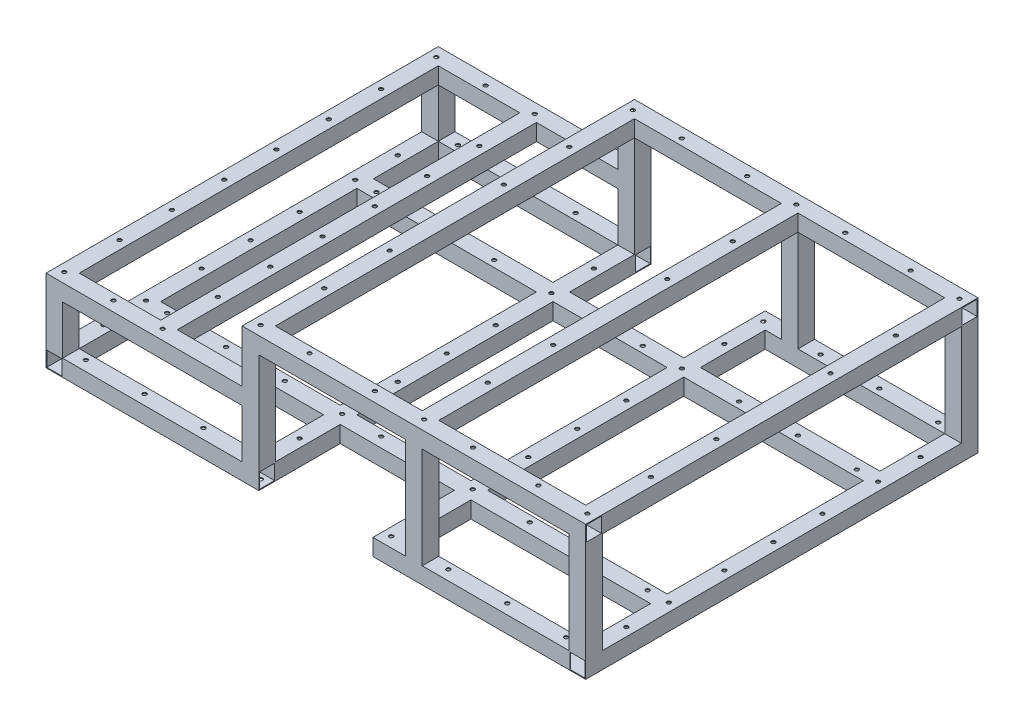
from build123d import *

# Parameters (mm, degrees)
SKETCH1_W                      = 774.6
SKETCH1_H                      = 25.4
BOSS_EXTRUDE1_DEPTH            = 25.4
BOSS_EXTRUDE1_2_DEPTH          = 25.4
SKETCH4_W                      = 23
SKETCH4_H                      = 23
CUT_EXTRUDE2_DEPTH             = 774.6
SKETCH2_W                      = 25.4
SKETCH2_H                      = 600
BOSS_EXTRUDE2_DEPTH            = 25.4
CUT_EXTRUDE1_REACH             = 730.674
SKETCH3_W                      = 23
SKETCH3_H                      = 23
SKETCH6_W                      = 25.4
SKETCH6_H                      = 25.4
BOSS_EXTRUDE3_DEPTH            = 300
SKETCH7_W                      = 25.4
SKETCH7_H                      = 25.4
BOSS_EXTRUDE4_DEPTH            = 300
CUT_EXTRUDE4_REACH             = 512.849
SKETCH8_W                      = 23
SKETCH8_H                      = 23
CUT_EXTRUDE4_DIRECTION_2_DEPTH = 388.5
BOSS_EXTRUDE5_REACH            = 709.906
SKETCH9_W                      = 25.4
SKETCH9_H                      = 25.4
SKETCH9_W_2                    = 23
SKETCH9_H_2                    = 23
SKETCH11_W                     = 25.4
SKETCH11_H                     = 25.4
SKETCH11_W_2                   = 23
SKETCH11_H_2                   = 23
BOSS_EXTRUDE6_DEPTH            = 74.6
SKETCH12_W                     = 25.4
SKETCH12_H                     = 25.4
SKETCH12_W_2                   = 23
SKETCH12_H_2                   = 23
BOSS_EXTRUDE7_DEPTH            = 154.6
SKETCH13_W                     = 525.4
SKETCH13_H                     = 25.4
BOSS_EXTRUDE9_DEPTH            = 25.4
SKETCH14_W                     = 23
SKETCH14_H                     = 23
CUT_EXTRUDE5_DEPTH             = 525.4
SKETCH15_W                     = 25.4
SKETCH15_H                     = 25.4
SKETCH15_W_2                   = 23
SKETCH15_H_2                   = 23
BOSS_EXTRUDE10_DEPTH           = 549.2
SKETCH16_W                     = 25.4
SKETCH16_H                     = 25.4
SKETCH16_W_2                   = 23
SKETCH16_H_2                   = 23
BOSS_EXTRUDE11_DEPTH           = 300
SKETCH17_W                     = 25.4
SKETCH17_H                     = 25.4
SKETCH17_W_2                   = 23
SKETCH17_H_2                   = 23
BOSS_EXTRUDE12_DEPTH           = 549.2
SKETCH18_R                     = 3
CUT_EXTRUDE6_DEPTH             = 25.4
SKETCH20_R                     = 3
CUT_EXTRUDE7_DEPTH             = 1.2
CUT_EXTRUDE8_REACH             = 527.401
SKETCH21_R                     = 3


with BuildPart() as part:
    # Sketch1 → Boss-Extrude1 (new body)
    with BuildSketch(Plane(origin=(0, 0, 0), x_dir=(1, 0, 0), z_dir=(0, 1, 0))):
        with Locations((0, -162.7)):
            Rectangle(SKETCH1_W, SKETCH1_H)
    extrude(amount=BOSS_EXTRUDE1_DEPTH)


with BuildPart() as body_2:
    # Sketch1 → Boss-Extrude1 2 (new body)
    with BuildSketch(Plane(origin=(0, 0, 0), x_dir=(1, 0, 0), z_dir=(0, 1, 0))):
        with Locations((0, 162.7)):
            Rectangle(SKETCH1_W, SKETCH1_H)
    extrude(amount=BOSS_EXTRUDE1_2_DEPTH)


with BuildPart() as cut_extrude2_tool:
    # Sketch4 → Cut-Extrude2 (new body)
    with BuildSketch(Plane.ZY.offset(387.3)):
        with Locations((-162.7, 12.7)):
            Rectangle(SKETCH4_W, SKETCH4_H)
        with Locations((162.7, 12.7)):
            Rectangle(SKETCH4_W, SKETCH4_H)
    extrude(amount=-CUT_EXTRUDE2_DEPTH)


with BuildPart() as part_1:
    add(part.part)

    # Cut-Extrude2: cut by cut_extrude2_tool
    add(cut_extrude2_tool.part, mode=Mode.SUBTRACT)



with BuildPart() as body_2_1:
    add(body_2.part)

    # Cut-Extrude2: cut by cut_extrude2_tool
    add(cut_extrude2_tool.part, mode=Mode.SUBTRACT)


with BuildPart() as part_2:
    add(part_1.part)

    add(body_2_1.part)  # Boss-Extrude2 merges body 2
    # Sketch2 → Boss-Extrude2 (add)
    with BuildSketch(Plane.XZ):
        with Locations((400, 0)):
            Rectangle(SKETCH2_W, SKETCH2_H)
        with Locations((-400, 0)):
            Rectangle(SKETCH2_W, SKETCH2_H)
    extrude(amount=-BOSS_EXTRUDE2_DEPTH)

    # Sketch3 → Cut-Extrude1 (cut, up to next)
    with BuildSketch(Plane(origin=(0, 0, -300), x_dir=(-1, 0, 0), z_dir=(0, 0, -1)), mode=Mode.PRIVATE) as cut_extrude1_sk1:
        with Locations((-400, 12.7)):
            Rectangle(SKETCH3_W, SKETCH3_H)
    cut_extrude1_tool1 = extrude(cut_extrude1_sk1.sketch, amount=-CUT_EXTRUDE1_REACH, mode=Mode.PRIVATE) & part_2.part
    # Sketch3 → Cut-Extrude1 (cut, up to next)
    with BuildSketch(Plane(origin=(0, 0, -300), x_dir=(-1, 0, 0), z_dir=(0, 0, -1)), mode=Mode.PRIVATE) as cut_extrude1_sk2:
        with Locations((400, 12.7)):
            Rectangle(SKETCH3_W, SKETCH3_H)
    cut_extrude1_tool2 = extrude(cut_extrude1_sk2.sketch, amount=-CUT_EXTRUDE1_REACH, mode=Mode.PRIVATE) & part_2.part
    add(cut_extrude1_tool1.solids().sort_by_distance((400, 12.7, -300))[0], mode=Mode.SUBTRACT)
    add(cut_extrude1_tool2.solids().sort_by_distance((-400, 12.7, -300))[0], mode=Mode.SUBTRACT)

    # Sketch6 → Boss-Extrude3 (add)
    with BuildSketch(Plane(origin=(-387.3, 0, 0), x_dir=(0, 0, -1), z_dir=(1, 0, 0))):
        with Locations((287.3, 12.7)):
            Rectangle(SKETCH6_W, SKETCH6_H)
        with Locations((-287.3, 12.7)):
            Rectangle(SKETCH6_W, SKETCH6_H)
    extrude(amount=BOSS_EXTRUDE3_DEPTH)

    # Sketch7 → Boss-Extrude4 (add)
    with BuildSketch(Plane.ZY.offset(-387.3)):
        with Locations((-287.3, 12.7)):
            Rectangle(SKETCH7_W, SKETCH7_H)
        with Locations((287.3, 12.7)):
            Rectangle(SKETCH7_W, SKETCH7_H)
    extrude(amount=BOSS_EXTRUDE4_DEPTH)

    # Cut-Extrude4: up to this face of the body (flat: up to its plane)
    cut_extrude4_end = Plane(part_2.part.faces().sort_by_distance((-388.5, 12.7, 0))[0])
    # Sketch8 → Cut-Extrude4 (cut, up to the picked face)
    with BuildSketch(Plane(origin=(0, 0, 0), x_dir=(0, 0, -1), z_dir=(1, 0, 0)), mode=Mode.PRIVATE) as cut_extrude4_sk1:
        with Locations((-287.3, 12.7)):
            Rectangle(SKETCH8_W, SKETCH8_H)
    cut_extrude4_tool1 = split(extrude(cut_extrude4_sk1.sketch, amount=-CUT_EXTRUDE4_REACH, mode=Mode.PRIVATE), bisect_by=cut_extrude4_end, keep=Keep.BOTH, mode=Mode.PRIVATE)
    # Sketch8 → Cut-Extrude4 (cut, up to the picked face)
    with BuildSketch(Plane(origin=(0, 0, 0), x_dir=(0, 0, -1), z_dir=(1, 0, 0)), mode=Mode.PRIVATE) as cut_extrude4_sk2:
        with Locations((287.3, 12.7)):
            Rectangle(SKETCH8_W, SKETCH8_H)
    cut_extrude4_tool2 = split(extrude(cut_extrude4_sk2.sketch, amount=-CUT_EXTRUDE4_REACH, mode=Mode.PRIVATE), bisect_by=cut_extrude4_end, keep=Keep.BOTH, mode=Mode.PRIVATE)
    add(cut_extrude4_tool1.solids().sort_by(Axis((0, 12.7, 287.3), (-1, 0, 0)))[0], mode=Mode.SUBTRACT)
    add(cut_extrude4_tool2.solids().sort_by(Axis((0, 12.7, -287.3), (-1, 0, 0)))[0], mode=Mode.SUBTRACT)

    # Sketch8 → Cut-Extrude4 direction 2 (cut)
    with BuildSketch(Plane(origin=(0, 0, 0), x_dir=(0, 0, -1), z_dir=(1, 0, 0))):
        with Locations((-287.3, 12.7)):
            Rectangle(SKETCH8_W, SKETCH8_H)
        with Locations((287.3, 12.7)):
            Rectangle(SKETCH8_W, SKETCH8_H)
    extrude(amount=CUT_EXTRUDE4_DIRECTION_2_DEPTH, mode=Mode.SUBTRACT)

    # Boss-Extrude5: up to this face of the body (flat: up to its plane)
    boss_extrude5_end = Plane(part_2.part.faces().sort_by_distance((-237.9, 12.7, 275.8))[0])
    # Sketch9 → Boss-Extrude5 (add, up to the picked face)
    with BuildSketch(Plane.XY.offset(-274.6), mode=Mode.PRIVATE) as boss_extrude5_sk1:
        with Locations((-100, 12.7)):
            Rectangle(SKETCH9_W, SKETCH9_H)
        with Locations((-100, 12.7)):
            Rectangle(SKETCH9_W_2, SKETCH9_H_2, mode=Mode.SUBTRACT)
    boss_extrude5_tool1 = split(extrude(boss_extrude5_sk1.sketch, amount=BOSS_EXTRUDE5_REACH, mode=Mode.PRIVATE), bisect_by=boss_extrude5_end, keep=Keep.BOTH, mode=Mode.PRIVATE)
    # Sketch9 → Boss-Extrude5 (add, up to the picked face)
    with BuildSketch(Plane.XY.offset(-274.6), mode=Mode.PRIVATE) as boss_extrude5_sk2:
        with Locations((100, 12.7)):
            Rectangle(SKETCH9_W, SKETCH9_H)
        with Locations((100, 12.7)):
            Rectangle(SKETCH9_W_2, SKETCH9_H_2, mode=Mode.SUBTRACT)
    boss_extrude5_tool2 = split(extrude(boss_extrude5_sk2.sketch, amount=BOSS_EXTRUDE5_REACH, mode=Mode.PRIVATE), bisect_by=boss_extrude5_end, keep=Keep.BOTH, mode=Mode.PRIVATE)
    add(boss_extrude5_tool1.solids().sort_by(Axis((-100, 0.35921, -274.6), (0, 0, 1)))[0])
    add(boss_extrude5_tool2.solids().sort_by(Axis((100, 25.04079, -274.6), (0, 0, 1)))[0])

    # Sketch11 → Boss-Extrude6 (add)
    # profile 1 of 2: a face of its own
    with BuildSketch(Plane(origin=(0, 25.4, 0), x_dir=(1, 0, 0), z_dir=(0, 1, 0))):
        with Locations((-400, 287.3)):
            Rectangle(SKETCH11_W, SKETCH11_H)
        with Locations((-400, 287.3)):
            Rectangle(SKETCH11_W_2, SKETCH11_H_2, mode=Mode.SUBTRACT)
    # profile 2 of 2: a face of its own
    with BuildSketch(Plane(origin=(0, 25.4, 0), x_dir=(1, 0, 0), z_dir=(0, 1, 0))):
        with Locations((-400, -287.3)):
            Rectangle(SKETCH11_W, SKETCH11_H)
        with Locations((-400, -287.3)):
            Rectangle(SKETCH11_W_2, SKETCH11_H_2, mode=Mode.SUBTRACT)
    extrude(amount=BOSS_EXTRUDE6_DEPTH)

    # Sketch12 → Boss-Extrude7 (add)
    # profile 1 of 6: a face of its own
    with BuildSketch(Plane(origin=(0, 25.4, 0), x_dir=(1, 0, 0), z_dir=(0, 1, 0))):
        with Locations((-100, 287.3)):
            Rectangle(SKETCH12_W, SKETCH12_H)
        with Locations((-100, 287.3)):
            Rectangle(SKETCH12_W_2, SKETCH12_H_2, mode=Mode.SUBTRACT)
    # profile 2 of 6: a face of its own
    with BuildSketch(Plane(origin=(0, 25.4, 0), x_dir=(1, 0, 0), z_dir=(0, 1, 0))):
        with Locations((-100, -287.3)):
            Rectangle(SKETCH12_W, SKETCH12_H)
        with Locations((-100, -287.3)):
            Rectangle(SKETCH12_W_2, SKETCH12_H_2, mode=Mode.SUBTRACT)
    # profile 3 of 6: a face of its own
    with BuildSketch(Plane(origin=(0, 25.4, 0), x_dir=(1, 0, 0), z_dir=(0, 1, 0))):
        with Locations((400, -287.3)):
            Rectangle(SKETCH12_W, SKETCH12_H)
        with Locations((400, -287.3)):
            Rectangle(SKETCH12_W_2, SKETCH12_H_2, mode=Mode.SUBTRACT)
    # profile 4 of 6: a face of its own
    with BuildSketch(Plane(origin=(0, 25.4, 0), x_dir=(1, 0, 0), z_dir=(0, 1, 0))):
        with Locations((400, 287.3)):
            Rectangle(SKETCH12_W, SKETCH12_H)
        with Locations((400, 287.3)):
            Rectangle(SKETCH12_W_2, SKETCH12_H_2, mode=Mode.SUBTRACT)
    # profile 5 of 6: a face of its own
    with BuildSketch(Plane(origin=(0, 25.4, 0), x_dir=(1, 0, 0), z_dir=(0, 1, 0))):
        with Locations((150, 287.3)):
            Rectangle(SKETCH12_W, SKETCH12_H)
        with Locations((150, 287.3)):
            Rectangle(SKETCH12_W_2, SKETCH12_H_2, mode=Mode.SUBTRACT)
    # profile 6 of 6: a face of its own
    with BuildSketch(Plane(origin=(0, 25.4, 0), x_dir=(1, 0, 0), z_dir=(0, 1, 0))):
        with Locations((150, -287.3)):
            Rectangle(SKETCH12_W, SKETCH12_H)
        with Locations((150, -287.3)):
            Rectangle(SKETCH12_W_2, SKETCH12_H_2, mode=Mode.SUBTRACT)
    extrude(amount=BOSS_EXTRUDE7_DEPTH)

    # Sketch13 → Boss-Extrude9 (add)
    with BuildSketch(Plane(origin=(0, 180, 0), x_dir=(1, 0, 0), z_dir=(0, 1, 0))):
        with Locations((150, -287.3)):
            Rectangle(SKETCH13_W, SKETCH13_H)
        with Locations((150, 287.3)):
            Rectangle(SKETCH13_W, SKETCH13_H)
    extrude(amount=BOSS_EXTRUDE9_DEPTH)

    # Sketch14 → Cut-Extrude5 (cut)
    with BuildSketch(Plane.ZY.offset(112.7)):
        with Locations((-287.3, 192.7)):
            Rectangle(SKETCH14_W, SKETCH14_H)
        with Locations((287.3, 192.7)):
            Rectangle(SKETCH14_W, SKETCH14_H)
    extrude(amount=-CUT_EXTRUDE5_DEPTH, mode=Mode.SUBTRACT)

    # Sketch15 → Boss-Extrude10 (add)
    # profile 1 of 3: a face of its own
    with BuildSketch(Plane.XY.offset(-274.6)):
        with Locations((-100, 192.7)):
            Rectangle(SKETCH15_W, SKETCH15_H)
        with Locations((-100, 192.7)):
            Rectangle(SKETCH15_W_2, SKETCH15_H_2, mode=Mode.SUBTRACT)
    # profile 2 of 3: a face of its own
    with BuildSketch(Plane.XY.offset(-274.6)):
        with Locations((150, 192.7)):
            Rectangle(SKETCH15_W, SKETCH15_H)
        with Locations((150, 192.7)):
            Rectangle(SKETCH15_W_2, SKETCH15_H_2, mode=Mode.SUBTRACT)
    # profile 3 of 3: a face of its own
    with BuildSketch(Plane.XY.offset(-274.6)):
        with Locations((400, 192.7)):
            Rectangle(SKETCH15_W, SKETCH15_H)
        with Locations((400, 192.7)):
            Rectangle(SKETCH15_W_2, SKETCH15_H_2, mode=Mode.SUBTRACT)
    extrude(amount=BOSS_EXTRUDE10_DEPTH)

    # Sketch16 → Boss-Extrude11 (add)
    # profile 1 of 2: a face of its own
    with BuildSketch(Plane.ZY.offset(412.7)):
        with Locations((287.3, 112.7)):
            Rectangle(SKETCH16_W, SKETCH16_H)
        with Locations((287.3, 112.7)):
            Rectangle(SKETCH16_W_2, SKETCH16_H_2, mode=Mode.SUBTRACT)
    # profile 2 of 2: a face of its own
    with BuildSketch(Plane.ZY.offset(412.7)):
        with Locations((-287.3, 112.7)):
            Rectangle(SKETCH16_W, SKETCH16_H)
        with Locations((-287.3, 112.7)):
            Rectangle(SKETCH16_W_2, SKETCH16_H_2, mode=Mode.SUBTRACT)
    extrude(amount=-BOSS_EXTRUDE11_DEPTH)

    # Sketch17 → Boss-Extrude12 (add)
    # profile 1 of 2: a face of its own
    with BuildSketch(Plane(origin=(0, 0, 274.6), x_dir=(-1, 0, 0), z_dir=(0, 0, -1))):
        with Locations((400, 112.7)):
            Rectangle(SKETCH17_W, SKETCH17_H)
        with Locations((400, 112.7)):
            Rectangle(SKETCH17_W_2, SKETCH17_H_2, mode=Mode.SUBTRACT)
    # profile 2 of 2: a face of its own
    with BuildSketch(Plane(origin=(0, 0, 274.6), x_dir=(-1, 0, 0), z_dir=(0, 0, -1))):
        with Locations((250, 112.7)):
            Rectangle(SKETCH17_W, SKETCH17_H)
        with Locations((250, 112.7)):
            Rectangle(SKETCH17_W_2, SKETCH17_H_2, mode=Mode.SUBTRACT)
    extrude(amount=BOSS_EXTRUDE12_DEPTH)

    # Sketch18 → Cut-Extrude6 (cut)
    with BuildSketch(Plane(origin=(0, 25.4, 0), x_dir=(1, 0, 0), z_dir=(0, 1, 0))):
        with Locations(Location((367.3, 284.6, 0), (0, 0, 270))):
            Circle(SKETCH18_R)
        with Locations(Location((277.3, 284.6, 0), (0, 0, 270))):
            Circle(SKETCH18_R)
        with Locations(Location((187.3, 284.6, 0), (0, 0, 270))):
            Circle(SKETCH18_R)
        with Locations(Location((99.8, 284.6, 0), (0, 0, 270))):
            Circle(SKETCH18_R)
        with Locations(Location((367.3, 160, 0), (0, 0, 270))):
            Circle(SKETCH18_R)
        with Locations(Location((277.3, 160, 0), (0, 0, 270))):
            Circle(SKETCH18_R)
        with Locations(Location((187.3, 160, 0), (0, 0, 270))):
            Circle(SKETCH18_R)
        with Locations(Location((99.8, 160, 0), (0, 0, 270))):
            Circle(SKETCH18_R)
        with Locations(Location((99.8, 225, 0), (0, 0, 270))):
            Circle(SKETCH18_R)
        with Locations(Location((399.8, 225, 0), (0, 0, 270))):
            Circle(SKETCH18_R)
        with Locations(Location((399.8, 0, 0), (0, 0, 270))):
            Circle(SKETCH18_R)
        with Locations(Location((399.8, 75, 0), (0, 0, 270))):
            Circle(SKETCH18_R)
        with Locations(Location((99.8, 0, 0), (0, 0, 270))):
            Circle(SKETCH18_R)
        with Locations(Location((99.8, 75, 0), (0, 0, 270))):
            Circle(SKETCH18_R)
        with Locations(Location((399.8, 160, 0), (0, 0, 270))):
            Circle(SKETCH18_R)
        with Locations(Location((40, 160, 0), (0, 0, 270))):
            Circle(SKETCH18_R)
        with Locations(Location((-40, 160, 0), (0, 0, 270))):
            Circle(SKETCH18_R)
        with Locations(Location((-399.8, 160, 0), (0, 0, 270))):
            Circle(SKETCH18_R)
        with Locations((-99.8, 75)):
            Circle(SKETCH18_R)
        with Locations((-99.8, 0)):
            Circle(SKETCH18_R)
        with Locations(Location((-399.8, 75, 0), (0, 0, 270))):
            Circle(SKETCH18_R)
        with Locations(Location((-399.8, 0, 0), (0, 0, 270))):
            Circle(SKETCH18_R)
        with Locations(Location((-399.8, 225, 0), (0, 0, 270))):
            Circle(SKETCH18_R)
        with Locations((-99.8, 225)):
            Circle(SKETCH18_R)
        with Locations(Location((-99.8, 160, 0), (0, 0, 270))):
            Circle(SKETCH18_R)
        with Locations(Location((-187.3, 160, 0), (0, 0, 270))):
            Circle(SKETCH18_R)
        with Locations(Location((-277.3, 160, 0), (0, 0, 270))):
            Circle(SKETCH18_R)
        with Locations(Location((-367.3, 160, 0), (0, 0, 270))):
            Circle(SKETCH18_R)
        with Locations(Location((-99.8, 284.6, 0), (0, 0, 270))):
            Circle(SKETCH18_R)
        with Locations(Location((-187.3, 284.6, 0), (0, 0, 270))):
            Circle(SKETCH18_R)
        with Locations(Location((-277.3, 284.6, 0), (0, 0, 270))):
            Circle(SKETCH18_R)
        with Locations(Location((-367.3, 284.6, 0), (0, 0, 270))):
            Circle(SKETCH18_R)
        with Locations(Location((-367.3, -284.6, 0), (0, 0, 270))):
            Circle(SKETCH18_R)
        with Locations(Location((-277.3, -284.6, 0), (0, 0, 270))):
            Circle(SKETCH18_R)
        with Locations(Location((-187.3, -284.6, 0), (0, 0, 270))):
            Circle(SKETCH18_R)
        with Locations(Location((-99.8, -284.6, 0), (0, 0, 270))):
            Circle(SKETCH18_R)
        with Locations(Location((-367.3, -160, 0), (0, 0, 270))):
            Circle(SKETCH18_R)
        with Locations(Location((-277.3, -160, 0), (0, 0, 270))):
            Circle(SKETCH18_R)
        with Locations(Location((-187.3, -160, 0), (0, 0, 270))):
            Circle(SKETCH18_R)
        with Locations(Location((-99.8, -160, 0), (0, 0, 270))):
            Circle(SKETCH18_R)
        with Locations(Location((-99.8, -225, 0), (0, 0, 270))):
            Circle(SKETCH18_R)
        with Locations(Location((-399.8, -225, 0), (0, 0, 270))):
            Circle(SKETCH18_R)
        with Locations(Location((-399.8, -75, 0), (0, 0, 270))):
            Circle(SKETCH18_R)
        with Locations(Location((-99.8, -75, 0), (0, 0, 270))):
            Circle(SKETCH18_R)
        with Locations(Location((-399.8, -160, 0), (0, 0, 270))):
            Circle(SKETCH18_R)
        with Locations(Location((-40, -160, 0), (0, 0, 270))):
            Circle(SKETCH18_R)
        with Locations(Location((40, -160, 0), (0, 0, 270))):
            Circle(SKETCH18_R)
        with Locations(Location((399.8, -160, 0), (0, 0, 270))):
            Circle(SKETCH18_R)
        with Locations((99.8, -75)):
            Circle(SKETCH18_R)
        with Locations(Location((399.8, -75, 0), (0, 0, 270))):
            Circle(SKETCH18_R)
        with Locations(Location((399.8, -225, 0), (0, 0, 270))):
            Circle(SKETCH18_R)
        with Locations((99.8, -225)):
            Circle(SKETCH18_R)
        with Locations(Location((99.8, -160, 0), (0, 0, 270))):
            Circle(SKETCH18_R)
        with Locations(Location((187.3, -160, 0), (0, 0, 270))):
            Circle(SKETCH18_R)
        with Locations(Location((277.3, -160, 0), (0, 0, 270))):
            Circle(SKETCH18_R)
        with Locations(Location((367.3, -160, 0), (0, 0, 270))):
            Circle(SKETCH18_R)
        with Locations(Location((99.8, -284.6, 0), (0, 0, 270))):
            Circle(SKETCH18_R)
        with Locations(Location((187.3, -284.6, 0), (0, 0, 270))):
            Circle(SKETCH18_R)
        with Locations(Location((277.3, -284.6, 0), (0, 0, 270))):
            Circle(SKETCH18_R)
        with Locations(Location((367.3, -284.6, 0), (0, 0, 270))):
            Circle(SKETCH18_R)
    extrude(amount=-CUT_EXTRUDE6_DEPTH, mode=Mode.SUBTRACT)

    # Sketch20 → Cut-Extrude7 (cut)
    with BuildSketch(Plane(origin=(0, 205.4, 0), x_dir=(1, 0, 0), z_dir=(0, 1, 0))):
        with Locations(Location((399.8, 284.6, 0), (0, 0, 270))):
            Circle(SKETCH20_R)
        with Locations(Location((399.8, 187.3, 0), (0, 0, 270))):
            Circle(SKETCH20_R)
        with Locations(Location((325, 284.6, 0), (0, 0, 270))):
            Circle(SKETCH20_R)
        with Locations(Location((225, 284.6, 0), (0, 0, 270))):
            Circle(SKETCH20_R)
        with Locations(Location((150.2, 187.3, 0), (0, 0, 90))):
            Circle(SKETCH20_R)
        with Locations(Location((150.2, 284.6, 0), (0, 0, 270))):
            Circle(SKETCH20_R)
        with Locations(Location((150.2, 87.3, 0), (0, 0, 270))):
            Circle(SKETCH20_R)
        with Locations(Location((399.8, 87.3, 0), (0, 0, 90))):
            Circle(SKETCH20_R)
        with Locations(Location((399.8, -87.3, 0), (0, 0, 270))):
            Circle(SKETCH20_R)
        with Locations(Location((150.2, -87.3, 0), (0, 0, 90))):
            Circle(SKETCH20_R)
        with Locations(Location((150.2, -284.6, 0), (0, 0, 270))):
            Circle(SKETCH20_R)
        with Locations(Location((150.2, -187.3, 0), (0, 0, 270))):
            Circle(SKETCH20_R)
        with Locations(Location((225, -284.6, 0), (0, 0, 270))):
            Circle(SKETCH20_R)
        with Locations(Location((325, -284.6, 0), (0, 0, 270))):
            Circle(SKETCH20_R)
        with Locations(Location((399.8, -187.3, 0), (0, 0, 90))):
            Circle(SKETCH20_R)
        with Locations(Location((399.8, -284.6, 0), (0, 0, 270))):
            Circle(SKETCH20_R)
        with Locations(Location((-99.8, -284.6, 0), (0, 0, 270))):
            Circle(SKETCH20_R)
        with Locations(Location((-99.8, -187.3, 0), (0, 0, 270))):
            Circle(SKETCH20_R)
        with Locations(Location((-25, -284.6, 0), (0, 0, 270))):
            Circle(SKETCH20_R)
        with Locations(Location((75, -284.6, 0), (0, 0, 270))):
            Circle(SKETCH20_R)
        with Locations(Location((-99.8, -87.3, 0), (0, 0, 90))):
            Circle(SKETCH20_R)
        with Locations(Location((-99.8, 87.3, 0), (0, 0, 270))):
            Circle(SKETCH20_R)
        with Locations(Location((75, 284.6, 0), (0, 0, 270))):
            Circle(SKETCH20_R)
        with Locations(Location((-25, 284.6, 0), (0, 0, 270))):
            Circle(SKETCH20_R)
        with Locations(Location((-99.8, 187.3, 0), (0, 0, 90))):
            Circle(SKETCH20_R)
        with Locations(Location((-99.8, 284.6, 0), (0, 0, 270))):
            Circle(SKETCH20_R)
    extrude(amount=-CUT_EXTRUDE7_DEPTH, mode=Mode.SUBTRACT)

    # Sketch21 → Cut-Extrude8 (cut, up to next)
    with BuildSketch(Plane(origin=(0, 125.4, 0), x_dir=(1, 0, 0), z_dir=(0, 1, 0)), mode=Mode.PRIVATE) as cut_extrude8_sk1:
        with Locations(Location((-400.2, 284.6, 0), (0, 0, 270))):
            Circle(SKETCH21_R)
    cut_extrude8_tool1 = extrude(cut_extrude8_sk1.sketch, amount=-CUT_EXTRUDE8_REACH, mode=Mode.PRIVATE) & part_2.part
    # Sketch21 → Cut-Extrude8 (cut, up to next)
    with BuildSketch(Plane(origin=(0, 125.4, 0), x_dir=(1, 0, 0), z_dir=(0, 1, 0)), mode=Mode.PRIVATE) as cut_extrude8_sk2:
        with Locations(Location((-324.995, 284.6, 0), (0, 0, 270))):
            Circle(SKETCH21_R)
    cut_extrude8_tool2 = extrude(cut_extrude8_sk2.sketch, amount=-CUT_EXTRUDE8_REACH, mode=Mode.PRIVATE) & part_2.part
    # Sketch21 → Cut-Extrude8 (cut, up to next)
    with BuildSketch(Plane(origin=(0, 125.4, 0), x_dir=(1, 0, 0), z_dir=(0, 1, 0)), mode=Mode.PRIVATE) as cut_extrude8_sk3:
        with Locations(Location((-400.2, 200, 0), (0, 0, 270))):
            Circle(SKETCH21_R)
    cut_extrude8_tool3 = extrude(cut_extrude8_sk3.sketch, amount=-CUT_EXTRUDE8_REACH, mode=Mode.PRIVATE) & part_2.part
    # Sketch21 → Cut-Extrude8 (cut, up to next)
    with BuildSketch(Plane(origin=(0, 125.4, 0), x_dir=(1, 0, 0), z_dir=(0, 1, 0)), mode=Mode.PRIVATE) as cut_extrude8_sk4:
        with Locations(Location((-400.2, 120, 0), (0, 0, 270))):
            Circle(SKETCH21_R)
    cut_extrude8_tool4 = extrude(cut_extrude8_sk4.sketch, amount=-CUT_EXTRUDE8_REACH, mode=Mode.PRIVATE) & part_2.part
    # Sketch21 → Cut-Extrude8 (cut, up to next)
    with BuildSketch(Plane(origin=(0, 125.4, 0), x_dir=(1, 0, 0), z_dir=(0, 1, 0)), mode=Mode.PRIVATE) as cut_extrude8_sk5:
        with Locations(Location((-400.2, 40, 0), (0, 0, 270))):
            Circle(SKETCH21_R)
    cut_extrude8_tool5 = extrude(cut_extrude8_sk5.sketch, amount=-CUT_EXTRUDE8_REACH, mode=Mode.PRIVATE) & part_2.part
    # Sketch21 → Cut-Extrude8 (cut, up to next)
    with BuildSketch(Plane(origin=(0, 125.4, 0), x_dir=(1, 0, 0), z_dir=(0, 1, 0)), mode=Mode.PRIVATE) as cut_extrude8_sk6:
        with Locations(Location((-249.8, 40, 0), (0, 0, 90))):
            Circle(SKETCH21_R)
    cut_extrude8_tool6 = extrude(cut_extrude8_sk6.sketch, amount=-CUT_EXTRUDE8_REACH, mode=Mode.PRIVATE) & part_2.part
    # Sketch21 → Cut-Extrude8 (cut, up to next)
    with BuildSketch(Plane(origin=(0, 125.4, 0), x_dir=(1, 0, 0), z_dir=(0, 1, 0)), mode=Mode.PRIVATE) as cut_extrude8_sk7:
        with Locations(Location((-249.8, 120, 0), (0, 0, 90))):
            Circle(SKETCH21_R)
    cut_extrude8_tool7 = extrude(cut_extrude8_sk7.sketch, amount=-CUT_EXTRUDE8_REACH, mode=Mode.PRIVATE) & part_2.part
    # Sketch21 → Cut-Extrude8 (cut, up to next)
    with BuildSketch(Plane(origin=(0, 125.4, 0), x_dir=(1, 0, 0), z_dir=(0, 1, 0)), mode=Mode.PRIVATE) as cut_extrude8_sk8:
        with Locations(Location((-249.8, 200, 0), (0, 0, 90))):
            Circle(SKETCH21_R)
    cut_extrude8_tool8 = extrude(cut_extrude8_sk8.sketch, amount=-CUT_EXTRUDE8_REACH, mode=Mode.PRIVATE) & part_2.part
    # Sketch21 → Cut-Extrude8 (cut, up to next)
    with BuildSketch(Plane(origin=(0, 125.4, 0), x_dir=(1, 0, 0), z_dir=(0, 1, 0)), mode=Mode.PRIVATE) as cut_extrude8_sk9:
        with Locations(Location((-249.8, 284.6, 0), (0, 0, 270))):
            Circle(SKETCH21_R)
    cut_extrude8_tool9 = extrude(cut_extrude8_sk9.sketch, amount=-CUT_EXTRUDE8_REACH, mode=Mode.PRIVATE) & part_2.part
    # Sketch21 → Cut-Extrude8 (cut, up to next)
    with BuildSketch(Plane(origin=(0, 125.4, 0), x_dir=(1, 0, 0), z_dir=(0, 1, 0)), mode=Mode.PRIVATE) as cut_extrude8_sk10:
        with Locations(Location((-249.8, -284.6, 0), (0, 0, 270))):
            Circle(SKETCH21_R)
    cut_extrude8_tool10 = extrude(cut_extrude8_sk10.sketch, amount=-CUT_EXTRUDE8_REACH, mode=Mode.PRIVATE) & part_2.part
    # Sketch21 → Cut-Extrude8 (cut, up to next)
    with BuildSketch(Plane(origin=(0, 125.4, 0), x_dir=(1, 0, 0), z_dir=(0, 1, 0)), mode=Mode.PRIVATE) as cut_extrude8_sk11:
        with Locations(Location((-249.8, -200, 0), (0, 0, 270))):
            Circle(SKETCH21_R)
    cut_extrude8_tool11 = extrude(cut_extrude8_sk11.sketch, amount=-CUT_EXTRUDE8_REACH, mode=Mode.PRIVATE) & part_2.part
    # Sketch21 → Cut-Extrude8 (cut, up to next)
    with BuildSketch(Plane(origin=(0, 125.4, 0), x_dir=(1, 0, 0), z_dir=(0, 1, 0)), mode=Mode.PRIVATE) as cut_extrude8_sk12:
        with Locations(Location((-249.8, -120, 0), (0, 0, 270))):
            Circle(SKETCH21_R)
    cut_extrude8_tool12 = extrude(cut_extrude8_sk12.sketch, amount=-CUT_EXTRUDE8_REACH, mode=Mode.PRIVATE) & part_2.part
    # Sketch21 → Cut-Extrude8 (cut, up to next)
    with BuildSketch(Plane(origin=(0, 125.4, 0), x_dir=(1, 0, 0), z_dir=(0, 1, 0)), mode=Mode.PRIVATE) as cut_extrude8_sk13:
        with Locations(Location((-400.2, -40, 0), (0, 0, 90))):
            Circle(SKETCH21_R)
    cut_extrude8_tool13 = extrude(cut_extrude8_sk13.sketch, amount=-CUT_EXTRUDE8_REACH, mode=Mode.PRIVATE) & part_2.part
    # Sketch21 → Cut-Extrude8 (cut, up to next)
    with BuildSketch(Plane(origin=(0, 125.4, 0), x_dir=(1, 0, 0), z_dir=(0, 1, 0)), mode=Mode.PRIVATE) as cut_extrude8_sk14:
        with Locations(Location((-400.2, -120, 0), (0, 0, 90))):
            Circle(SKETCH21_R)
    cut_extrude8_tool14 = extrude(cut_extrude8_sk14.sketch, amount=-CUT_EXTRUDE8_REACH, mode=Mode.PRIVATE) & part_2.part
    # Sketch21 → Cut-Extrude8 (cut, up to next)
    with BuildSketch(Plane(origin=(0, 125.4, 0), x_dir=(1, 0, 0), z_dir=(0, 1, 0)), mode=Mode.PRIVATE) as cut_extrude8_sk15:
        with Locations(Location((-400.2, -200, 0), (0, 0, 90))):
            Circle(SKETCH21_R)
    cut_extrude8_tool15 = extrude(cut_extrude8_sk15.sketch, amount=-CUT_EXTRUDE8_REACH, mode=Mode.PRIVATE) & part_2.part
    # Sketch21 → Cut-Extrude8 (cut, up to next)
    with BuildSketch(Plane(origin=(0, 125.4, 0), x_dir=(1, 0, 0), z_dir=(0, 1, 0)), mode=Mode.PRIVATE) as cut_extrude8_sk16:
        with Locations(Location((-324.995, -284.6, 0), (0, 0, 270))):
            Circle(SKETCH21_R)
    cut_extrude8_tool16 = extrude(cut_extrude8_sk16.sketch, amount=-CUT_EXTRUDE8_REACH, mode=Mode.PRIVATE) & part_2.part
    # Sketch21 → Cut-Extrude8 (cut, up to next)
    with BuildSketch(Plane(origin=(0, 125.4, 0), x_dir=(1, 0, 0), z_dir=(0, 1, 0)), mode=Mode.PRIVATE) as cut_extrude8_sk17:
        with Locations(Location((-400.2, -284.6, 0), (0, 0, 270))):
            Circle(SKETCH21_R)
    cut_extrude8_tool17 = extrude(cut_extrude8_sk17.sketch, amount=-CUT_EXTRUDE8_REACH, mode=Mode.PRIVATE) & part_2.part
    # Sketch21 → Cut-Extrude8 (cut, up to next)
    with BuildSketch(Plane(origin=(0, 125.4, 0), x_dir=(1, 0, 0), z_dir=(0, 1, 0)), mode=Mode.PRIVATE) as cut_extrude8_sk18:
        with Locations(Location((-249.8, -40, 0), (0, 0, 270))):
            Circle(SKETCH21_R)
    cut_extrude8_tool18 = extrude(cut_extrude8_sk18.sketch, amount=-CUT_EXTRUDE8_REACH, mode=Mode.PRIVATE) & part_2.part
    add(cut_extrude8_tool1.solids().sort_by_distance((-400.2, 125.4, -284.6))[0], mode=Mode.SUBTRACT)
    add(cut_extrude8_tool2.solids().sort_by_distance((-324.995, 125.4, -284.6))[0], mode=Mode.SUBTRACT)
    add(cut_extrude8_tool3.solids().sort_by_distance((-400.2, 125.4, -200))[0], mode=Mode.SUBTRACT)
    add(cut_extrude8_tool4.solids().sort_by_distance((-400.2, 125.4, -120))[0], mode=Mode.SUBTRACT)
    add(cut_extrude8_tool5.solids().sort_by_distance((-400.2, 125.4, -40))[0], mode=Mode.SUBTRACT)
    add(cut_extrude8_tool6.solids().sort_by_distance((-249.8, 125.4, -40))[0], mode=Mode.SUBTRACT)
    add(cut_extrude8_tool7.solids().sort_by_distance((-249.8, 125.4, -120))[0], mode=Mode.SUBTRACT)
    add(cut_extrude8_tool8.solids().sort_by_distance((-249.8, 125.4, -200))[0], mode=Mode.SUBTRACT)
    add(cut_extrude8_tool9.solids().sort_by_distance((-249.8, 125.4, -284.6))[0], mode=Mode.SUBTRACT)
    add(cut_extrude8_tool10.solids().sort_by_distance((-249.8, 125.4, 284.6))[0], mode=Mode.SUBTRACT)
    add(cut_extrude8_tool11.solids().sort_by_distance((-249.8, 125.4, 200))[0], mode=Mode.SUBTRACT)
    add(cut_extrude8_tool12.solids().sort_by_distance((-249.8, 125.4, 120))[0], mode=Mode.SUBTRACT)
    add(cut_extrude8_tool13.solids().sort_by_distance((-400.2, 125.4, 40))[0], mode=Mode.SUBTRACT)
    add(cut_extrude8_tool14.solids().sort_by_distance((-400.2, 125.4, 120))[0], mode=Mode.SUBTRACT)
    add(cut_extrude8_tool15.solids().sort_by_distance((-400.2, 125.4, 200))[0], mode=Mode.SUBTRACT)
    add(cut_extrude8_tool16.solids().sort_by_distance((-324.995, 125.4, 284.6))[0], mode=Mode.SUBTRACT)
    add(cut_extrude8_tool17.solids().sort_by_distance((-400.2, 125.4, 284.6))[0], mode=Mode.SUBTRACT)
    add(cut_extrude8_tool18.solids().sort_by_distance((-249.8, 125.4, 40))[0], mode=Mode.SUBTRACT)


solid = part_2.part
